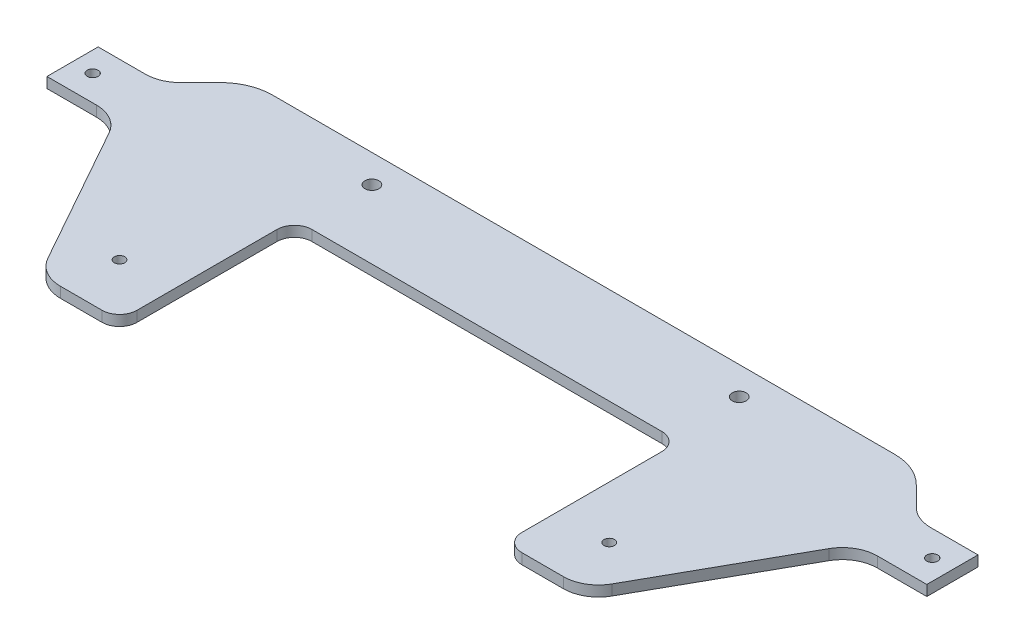
from build123d import *

# Parameters (mm, degrees)
SALIENTE_EXTRUIR1_DEPTH = 3
REDONDEO1_R             = 10
CROQUIS2_R              = 1.5
CROQUIS2_R_2            = 1.55
CORTAR_EXTRUIR1_DEPTH   = 135.610141171
CROQUIS4_W              = 110
CROQUIS4_H              = 50
CORTAR_EXTRUIR2_DEPTH   = 135.610141171
REDONDEO2_R             = 5
CROQUIS5_W              = 4
CROQUIS5_H              = 14.636342218
CORTAR_EXTRUIR3_DEPTH   = 135.610141171
CROQUIS6_W              = 14.636342218
CROQUIS6_H              = 3
SALIENTE_EXTRUIR2_DEPTH = 2
CROQUIS8_W              = 14.636342218
CROQUIS8_H              = 3
SALIENTE_EXTRUIR3_DEPTH = 2
CROQUIS9_W              = 196.2
CROQUIS9_H              = 31.087527503
CORTAR_EXTRUIR4_DEPTH   = 133.713564137
CROQUIS10_R             = 2
CORTAR_EXTRUIR5_DEPTH   = 133.713564137
REDONDEO6_R             = 15


with BuildPart() as part:
    # Croquis1 → Saliente-Extruir1 (new body)
    with BuildSketch(Plane(origin=(0, 0, 0), x_dir=(1, 0, 0), z_dir=(0, 1, 0))):
        Polygon((-88.1, 42.318171109), (88.1, 42.318171109), (108.1, 22.318171109), (127.75, 22.318171109), (127.75, 7.681828891), (105.75, 7.681828891), (77.75, -42.318171109), (-77.75, -42.318171109), (-105.75, 7.681828891), (-127.75, 7.681828891), (-127.75, 22.318171109), (-108.1, 22.318171109), align=None)
    extrude(amount=SALIENTE_EXTRUIR1_DEPTH)

    # Redondeo1
    redondeo1_edges = [part.edges().sort_by_distance(p)[0] for p in [
        (-88.1, 1.5, -42.318171109),
        (88.1, 1.5, -42.318171109),
        (108.1, 1.5, -22.318171109),
        (105.75, 1.5, -7.681828891),
        (77.75, 1.5, 42.318171109),
        (-77.75, 1.5, 42.318171109),
        (-105.75, 1.5, -7.681828891),
        (-108.1, 1.5, -22.318171109),
    ]]
    fillet(redondeo1_edges, radius=REDONDEO1_R)

    # Croquis2 → Cortar-Extruir1 (cut, through all)
    with BuildSketch(Plane(origin=(0, 3, 0), x_dir=(1, 0, 0), z_dir=(0, 1, 0))):
        with Locations(Location((70, -27.318171109, 0), (0, 0, 270))):
            Circle(CROQUIS2_R)
        with Locations(Location((-70, -27.318171109, 0), (0, 0, 270))):
            Circle(CROQUIS2_R)
        with Locations(Location((-119.996067812, 15, 0), (0, 0, 270))):
            Circle(CROQUIS2_R_2)
        with Locations(Location((119.996067812, 15, 0), (0, 0, 270))):
            Circle(CROQUIS2_R_2)
        with Locations(Location((-17.5, -17.318171109, 0), (0, 0, 270))):
            Circle(CROQUIS2_R)
        with Locations(Location((17.5, -17.318171109, 0), (0, 0, 270))):
            Circle(CROQUIS2_R)
        with Locations(Location((-17.5, -37.318171109, 0), (0, 0, 270))):
            Circle(CROQUIS2_R)
        with Locations(Location((17.5, -37.318171109, 0), (0, 0, 270))):
            Circle(CROQUIS2_R)
    extrude(amount=-CORTAR_EXTRUIR1_DEPTH, mode=Mode.SUBTRACT)

    # Croquis4 → Cortar-Extruir2 (cut, through all)
    with BuildSketch(Plane(origin=(0, 3, 0), x_dir=(1, 0, 0), z_dir=(0, 1, 0))):
        with Locations((0, -17.318171109)):
            Rectangle(CROQUIS4_W, CROQUIS4_H)
    extrude(amount=-CORTAR_EXTRUIR2_DEPTH, mode=Mode.SUBTRACT)

    # Redondeo2
    redondeo2_edges = [part.edges().sort_by_distance(p)[0] for p in [
        (55, 1.5, 42.318171109),
        (-55, 1.5, 42.318171109),
        (-55, 1.5, -7.681828891),
        (55, 1.5, -7.681828891),
    ]]
    fillet(redondeo2_edges, radius=REDONDEO2_R)

    # Croquis5 → Cortar-Extruir3 (cut, through all)
    with BuildSketch(Plane(origin=(0, 3, 0), x_dir=(1, 0, 0), z_dir=(0, 1, 0))):
        with Locations((-125.75, 15)):
            Rectangle(CROQUIS5_W, CROQUIS5_H)
        with Locations((125.75, 15)):
            Rectangle(CROQUIS5_W, CROQUIS5_H)
    extrude(amount=-CORTAR_EXTRUIR3_DEPTH, mode=Mode.SUBTRACT)

    # Croquis6 → Saliente-Extruir2 (add)
    with BuildSketch(Plane(origin=(123.75, 0, 0), x_dir=(0, 0, -1), z_dir=(1, 0, 0))):
        with Locations((15, 1.5)):
            Rectangle(CROQUIS6_W, CROQUIS6_H)
    extrude(amount=SALIENTE_EXTRUIR2_DEPTH)

    # Croquis8 → Saliente-Extruir3 (add)
    with BuildSketch(Plane.ZY.offset(123.75)):
        with Locations((-15, 1.5)):
            Rectangle(CROQUIS8_W, CROQUIS8_H)
    extrude(amount=SALIENTE_EXTRUIR3_DEPTH)

    # Croquis9 → Cortar-Extruir4 (cut, through all)
    with BuildSketch(Plane(origin=(0, 3, 0), x_dir=(1, 0, 0), z_dir=(0, 1, 0))):
        with Locations((0, 50.861934861)):
            Rectangle(CROQUIS9_W, CROQUIS9_H)
    extrude(amount=-CORTAR_EXTRUIR4_DEPTH, mode=Mode.SUBTRACT)

    # Croquis10 → Cortar-Extruir5 (cut, through all)
    with BuildSketch(Plane(origin=(0, 3, 0), x_dir=(1, 0, 0), z_dir=(0, 1, 0))):
        with Locations(Location((-52.5, 27.318171109, 0), (0, 0, 270))):
            Circle(CROQUIS10_R)
        with Locations(Location((52.5, 27.318171109, 0), (0, 0, 270))):
            Circle(CROQUIS10_R)
    extrude(amount=-CORTAR_EXTRUIR5_DEPTH, mode=Mode.SUBTRACT)

    # Redondeo6
    redondeo6_edges = [part.edges().sort_by_distance(p)[0] for p in [
        (-95.1, 1.5, -35.318171109),
        (95.1, 1.5, -35.318171109),
    ]]
    fillet(redondeo6_edges, radius=REDONDEO6_R)


solid = part.part
